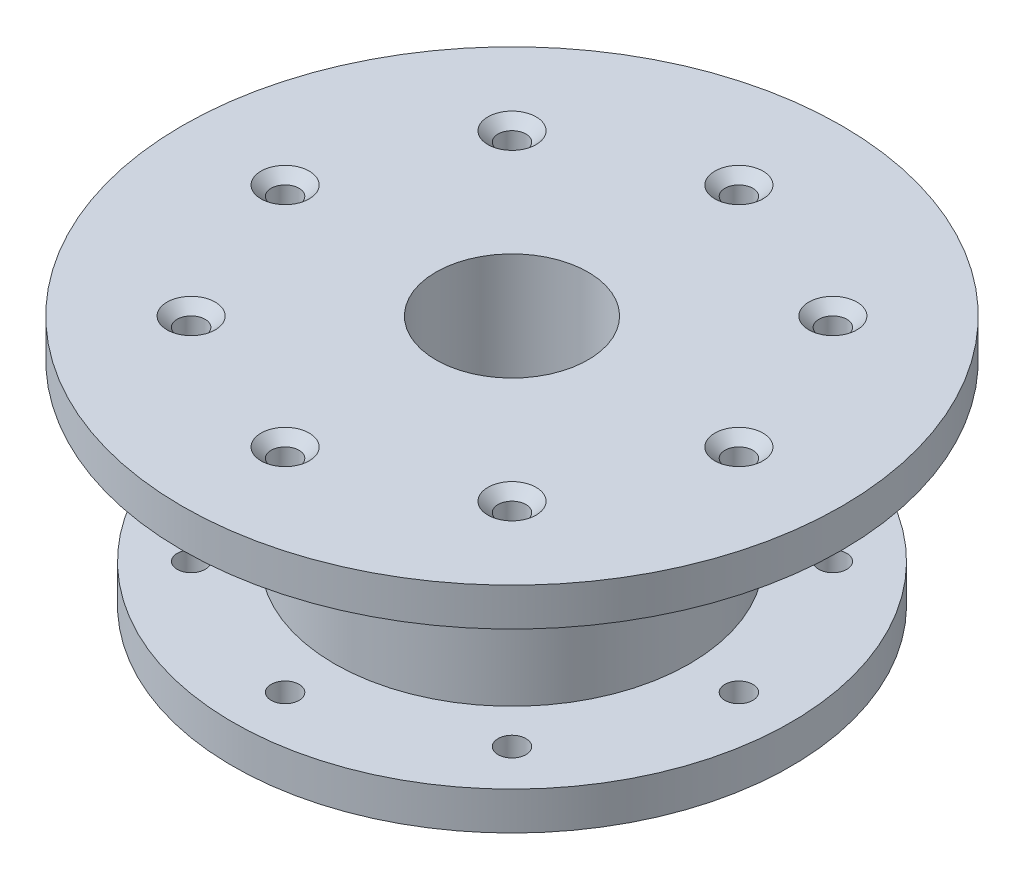
from build123d import *

# Parameters (mm, degrees)
CSK_FOR_M10_CROSS_COUNTERSUNK_HEAD_SCREW_D           = 11
CSK_FOR_M10_CROSS_COUNTERSUNK_HEAD_SCREW_CSINK_D     = 19
CSK_FOR_M10_CROSS_COUNTERSUNK_HEAD_SCREW_CSINK_ANGLE = 92
CIRPATTERN2_COUNT                                    = 8


with BuildPart() as part:
    # Sketch1 → Revolve2 (revolve)
    with BuildSketch(Plane.XY, mode=Mode.PRIVATE) as revolve2_sk:
        Polygon((13.106218235, 42.025554223), (113.106218235, 42.025554223), (113.106218235, 27.025554223), (53.106218235, 27.025554223), (53.106218235, -41.760408771), (93.106218235, -41.760408771), (93.106218235, -56.760408771), (13.106218235, -56.760408771), align=None)
    revolve(revolve2_sk.sketch.rotate(Axis((-16.893781765, 54.005560253, 0), (0, -1, 0)), 180), axis=Axis((-16.893781765, 54.005560253, 0), (0, -1, 0)))

    # CSK for M10 Cross Countersunk Head Screw1 (through all)
    with Locations(Plane(origin=(0, 42.025554223, 0), x_dir=(1, 0, 0), z_dir=(0, 1, 0))):
        with Locations((72.566522529, 0)):
            csk_for_m10_cross_countersunk_head_screw = CounterSinkHole(CSK_FOR_M10_CROSS_COUNTERSUNK_HEAD_SCREW_D / 2, CSK_FOR_M10_CROSS_COUNTERSUNK_HEAD_SCREW_CSINK_D / 2, counter_sink_angle=CSK_FOR_M10_CROSS_COUNTERSUNK_HEAD_SCREW_CSINK_ANGLE)

    # CirPattern2: CSK for M10 Cross Countersunk Head Screw1 ×8 about axis
    cirpattern2_axis = Axis((-16.893781765, 0, 0), (0, 1, 0))
    for i in range(1, CIRPATTERN2_COUNT):
        add(csk_for_m10_cross_countersunk_head_screw.rotate(cirpattern2_axis, i * 360 / CIRPATTERN2_COUNT), mode=Mode.SUBTRACT)


solid = part.part
